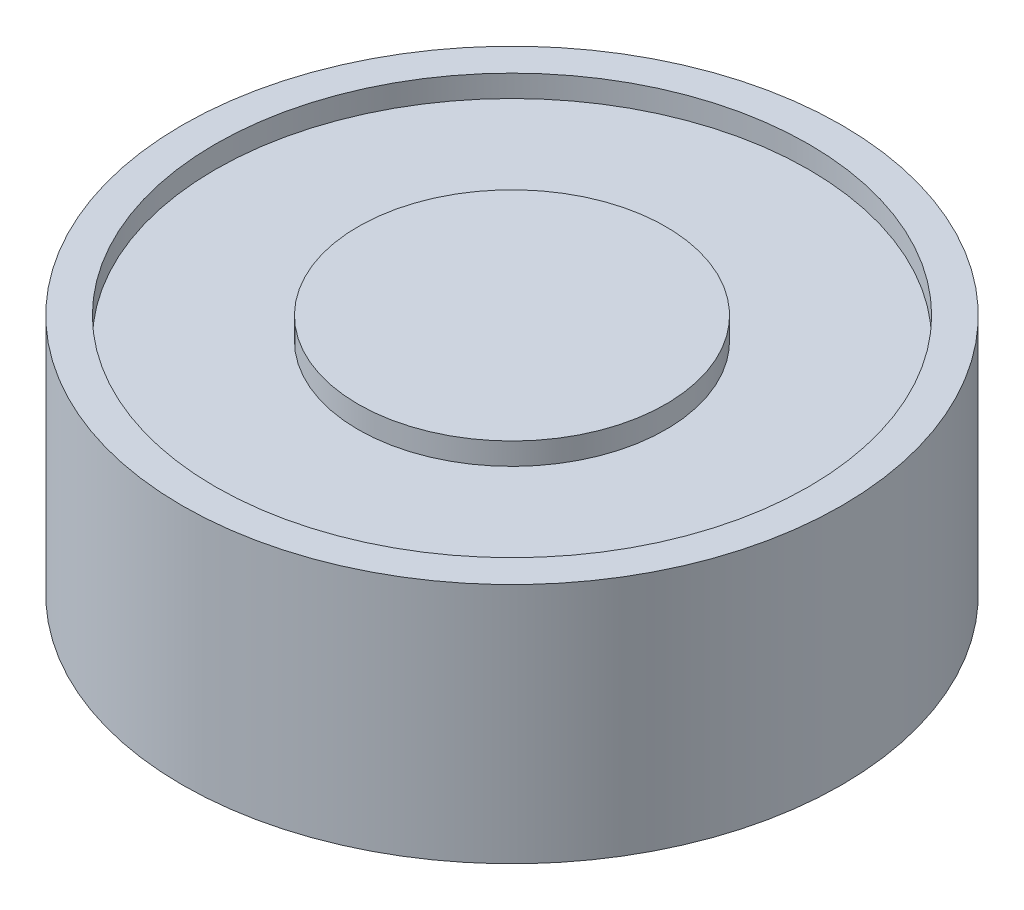
from build123d import *

# Parameters (mm, degrees)
SKETCH1_R                = 30
BOSS_EXTRUDE1_DEPTH      = 22
SKETCH2_R                = 27
CUT_EXTRUDE1_DEPTH       = 2
SKETCH3_R                = 14
BOSS_EXTRUDE2_DEPTH      = 2
M3_CLEARANCE_HOLE1_D     = 3.4
M3_CLEARANCE_HOLE1_DEPTH = 7
M3_CLEARANCE_HOLE1_TIP   = 1.021463052


with BuildPart() as part:
    # Sketch1 → Boss-Extrude1 (new body)
    with BuildSketch(Plane(origin=(0, 0, 0), x_dir=(1, 0, 0), z_dir=(0, 1, 0))):
        with Locations(Location((0, 0, 0), (0, 0, 270))):
            Circle(SKETCH1_R)
    extrude(amount=BOSS_EXTRUDE1_DEPTH)

    # Sketch2 → Cut-Extrude1 (cut)
    with BuildSketch(Plane(origin=(0, 22, 0), x_dir=(1, 0, 0), z_dir=(0, 1, 0))):
        with Locations(Location((0, 0, 0), (0, 0, 270))):
            Circle(SKETCH2_R)
    extrude(amount=-CUT_EXTRUDE1_DEPTH, mode=Mode.SUBTRACT)

    # Sketch3 → Boss-Extrude2 (add)
    with BuildSketch(Plane(origin=(0, 20, 0), x_dir=(1, 0, 0), z_dir=(0, 1, 0))):
        with Locations(Location((0, 0, 0), (0, 0, 270))):
            Circle(SKETCH3_R)
    extrude(amount=BOSS_EXTRUDE2_DEPTH)

    # M3 Clearance Hole1
    with Locations(Plane(origin=(0, 0, 0), x_dir=(-1, 0, 0), z_dir=(0, -1, 0))):
        with Locations((0, 0)):
            Hole(M3_CLEARANCE_HOLE1_D / 2, depth=M3_CLEARANCE_HOLE1_DEPTH)
            with Locations((0, 0, -(M3_CLEARANCE_HOLE1_DEPTH + M3_CLEARANCE_HOLE1_TIP / 2))):  # 118° drill point
                Cone(0, M3_CLEARANCE_HOLE1_D / 2, M3_CLEARANCE_HOLE1_TIP, mode=Mode.SUBTRACT)


solid = part.part
